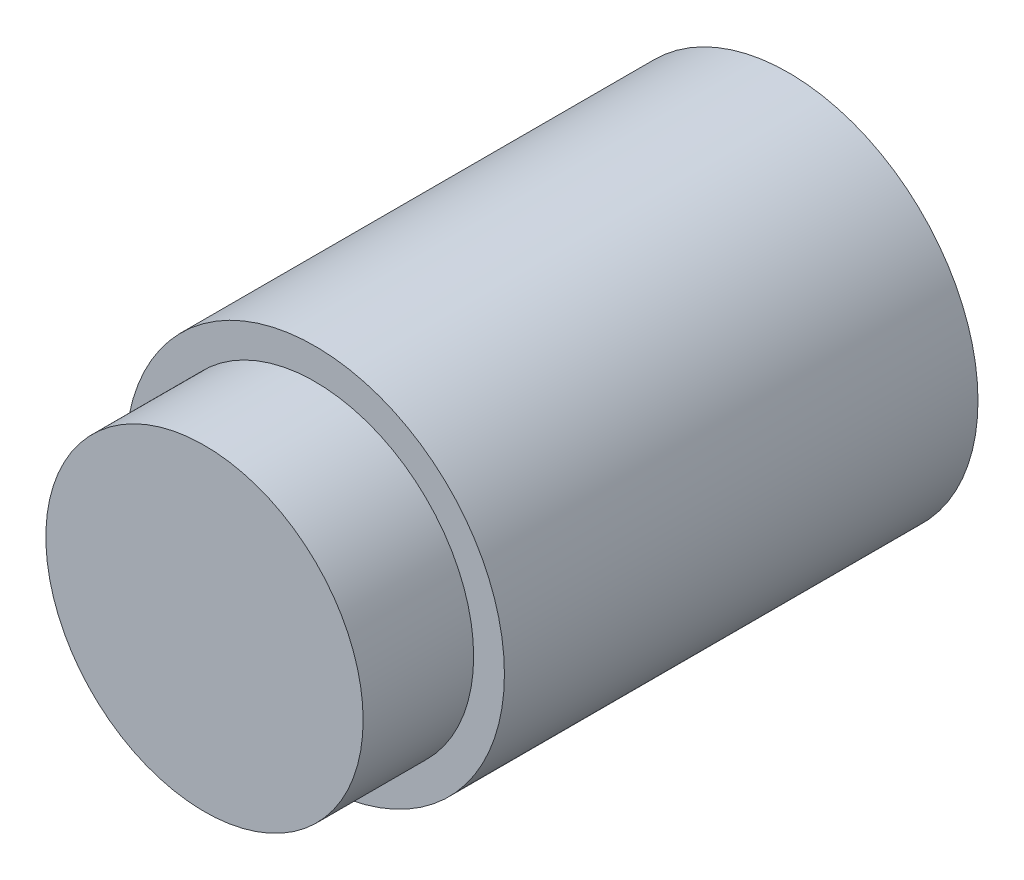
from build123d import *

# Parameters (mm, degrees)
SKETCH1_R           = 6
BOSS_EXTRUDE1_DEPTH = 15
SKETCH2_R           = 5.025
BOSS_EXTRUDE2_DEPTH = 3.5


with BuildPart() as part:
    # Sketch1 → Boss-Extrude1 (new body)
    with BuildSketch(Plane(origin=(0, 0, 0), x_dir=(0, 1, 0), z_dir=(0, 0, 1))):
        with Locations(Location((0, 0, 0), (0, 0, 270))):
            Circle(SKETCH1_R)
    extrude(amount=BOSS_EXTRUDE1_DEPTH)

    # Sketch2 → Boss-Extrude2 (add)
    with BuildSketch(Plane.XY.offset(15)):
        Circle(SKETCH2_R)
    extrude(amount=BOSS_EXTRUDE2_DEPTH)


solid = part.part
